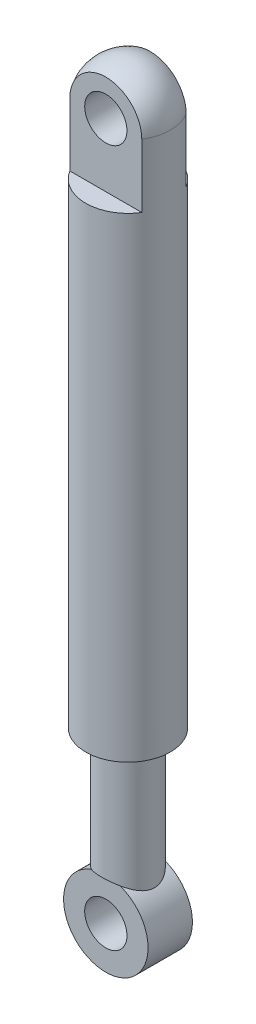
from build123d import *

# Parameters (mm, degrees)
CUT_EXTRUDE1_DEPTH      = 56.290143787
CUT_EXTRUDE1_DEPTH_BACK = 56.290143787
SKETCH4_3_R             = 4
SKETCH4_4_R             = 4
BOSS_EXTRUDE1_DEPTH     = 2.1
CUT_EXTRUDE2_DEPTH      = 56.290143794
CUT_EXTRUDE3_DEPTH      = 56.290143794
CUT_EXTRUDE3_DEPTH_BACK = 56.290143794
SKETCH1_R               = 2


with BuildPart() as part:
    # Sketch3 → Revolve2 (revolve)
    with BuildSketch(Plane.XY):
        with BuildLine():
            Line((0, 0), (4, 0))
            Line((4, 0), (4, 51))
            ThreePointArc((4, 51), (2.828427125, 53.828427125), (0, 55))
            Line((0, 55), (0, 0))
        make_face()
    revolve(axis=Axis((0, 0, 0), (0, 1, 0)))

    # Sketch4 → Revolve3 (revolve)
    with BuildSketch(Plane.XY):
        with BuildLine():
            Line((2.5, -11.877501001), (2.5, 0))
            Line((2.5, 0), (0, 0))
            Line((0, 0), (0, -11))
            ThreePointArc((0, -11), (1.324764885, -11.225745372), (2.5, -11.877501001))
        make_face()
    revolve(axis=Axis((0, 0, 0), (0, -1, 0)))

    # Sketch4<3> → Cut-Extrude1 (cut, two sides: drawn at the far end of the back side and taken through both)
    with BuildSketch(Plane.XY.offset(-CUT_EXTRUDE1_DEPTH_BACK)):
        with Locations((0, -15)):
            Circle(SKETCH4_3_R)
    extrude(amount=CUT_EXTRUDE1_DEPTH + CUT_EXTRUDE1_DEPTH_BACK, mode=Mode.SUBTRACT)

    # Sketch4<4> → Boss-Extrude1 (add, symmetric)
    with BuildSketch(Plane.XY):
        with Locations((0, -15)):
            Circle(SKETCH4_4_R)
    extrude(amount=BOSS_EXTRUDE1_DEPTH, both=True)

    # Sketch5 → Cut-Extrude2 (cut, symmetric)
    with BuildSketch(Plane(origin=(0, 0, 0), x_dir=(0, 0, -1), z_dir=(1, 0, 0))):
        Polygon((-2.1, 211.719272535), (-2.1, 54.404408906), (-2.1, 45), (-4, 45), (-161.314863629, 45), (-388.853749338, 262.296849414), (-229.638885709, 429.016121949), align=None)
    cut_extrude2 = extrude(amount=CUT_EXTRUDE2_DEPTH, both=True, mode=Mode.SUBTRACT)

    # Mirror1: Cut-Extrude2 across plane
    add(cut_extrude2.mirror(Plane.XY), mode=Mode.SUBTRACT)

    # Sketch1 → Cut-Extrude3 (cut, two sides: drawn at the far end of the back side and taken through both)
    with BuildSketch(Plane.XY.offset(-CUT_EXTRUDE3_DEPTH_BACK)):
        with Locations((0, 51)):
            Circle(SKETCH1_R)
        with Locations((0, -15)):
            Circle(SKETCH1_R)
    extrude(amount=CUT_EXTRUDE3_DEPTH + CUT_EXTRUDE3_DEPTH_BACK, mode=Mode.SUBTRACT)


solid = part.part
